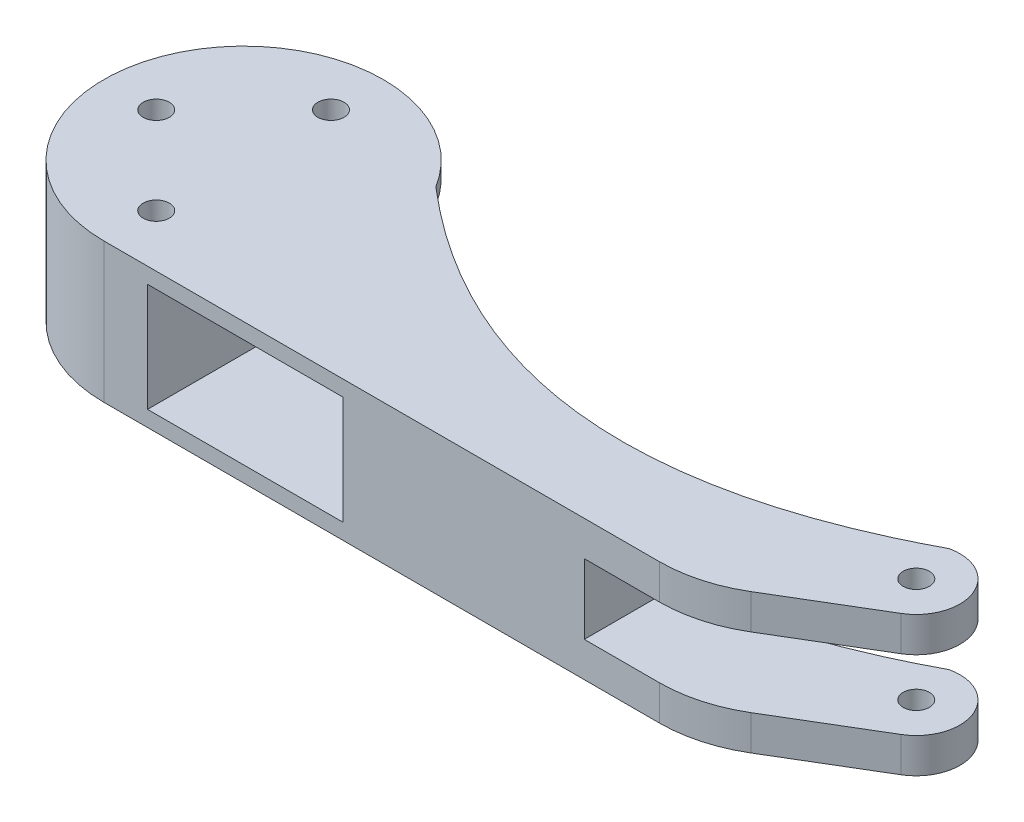
from build123d import *

# Parameters (mm, degrees)
SKETCH1_R           = 1.5
BOSS_EXTRUDE2_DEPTH = 16
FILLET1_R           = 16
SKETCH2_W           = 30
SKETCH2_H           = 8
CUT_EXTRUDE2_DEPTH  = 93.222557038
SKETCH3_W           = 22.4
SKETCH3_H           = 12.4
CUT_EXTRUDE3_DEPTH  = 93.222557038
SKETCH4_R           = 1.5
CUT_EXTRUDE4_DEPTH  = 88.960218414


with BuildPart() as part:
    # Sketch1 → Boss-Extrude2 (new body)
    with BuildSketch(Plane(origin=(0, 0, 0), x_dir=(1, 0, 0), z_dir=(0, 1, 0))):
        with BuildLine():
            Line((0, -16), (68, -16))
            Line((68, -16), (82.565771817, -7.291481677))
            ThreePointArc((82.565771817, -7.291481677), (84.636633862, -1.128736675), (78.868265673, 1.870233815))
            add(Edge.make_bspline(
                [(78.868265673, 1.870233815), (43.304736125, -17.072492838), (13.642052319, 8.360287586)],
                knots=[0.972219652, 0.972219652, 0.972219652, 1.878474777, 1.878474777, 1.878474777], degree=2))
            ThreePointArc((13.642052319, 8.360287586), (-13.960025096, 7.817780971), (0, -16))
        make_face()
        with Locations(Location((80, -3, 0), (0, 0, 270))):
            Circle(SKETCH1_R, mode=Mode.SUBTRACT)
    extrude(amount=BOSS_EXTRUDE2_DEPTH)

    # Fillet1
    fillet1_edges = [part.edges().sort_by_distance(p)[0] for p in [
        (68, 8, 16),
    ]]
    fillet(fillet1_edges, radius=FILLET1_R)

    # Sketch2 → Cut-Extrude2 (cut, through all)
    with BuildSketch(Plane.XY.offset(16)):
        with Locations((70, 8)):
            Rectangle(SKETCH2_W, SKETCH2_H)
    extrude(amount=-CUT_EXTRUDE2_DEPTH, mode=Mode.SUBTRACT)

    # Sketch3 → Cut-Extrude3 (cut, through all)
    with BuildSketch(Plane.XY.offset(16)):
        with Locations((16.2, 8)):
            Rectangle(SKETCH3_W, SKETCH3_H)
    extrude(amount=-CUT_EXTRUDE3_DEPTH, mode=Mode.SUBTRACT)

    # Sketch4 → Cut-Extrude4 (cut, through all)
    with BuildSketch(Plane.XZ):
        with Locations(Location((0, -10, 0), (0, 0, 270))):
            Circle(SKETCH4_R)
        with Locations(Location((-10, 0, 0), (0, 0, 270))):
            Circle(SKETCH4_R)
        with Locations(Location((0, 10, 0), (0, 0, 270))):
            Circle(SKETCH4_R)
    extrude(amount=-CUT_EXTRUDE4_DEPTH, mode=Mode.SUBTRACT)


solid = part.part
